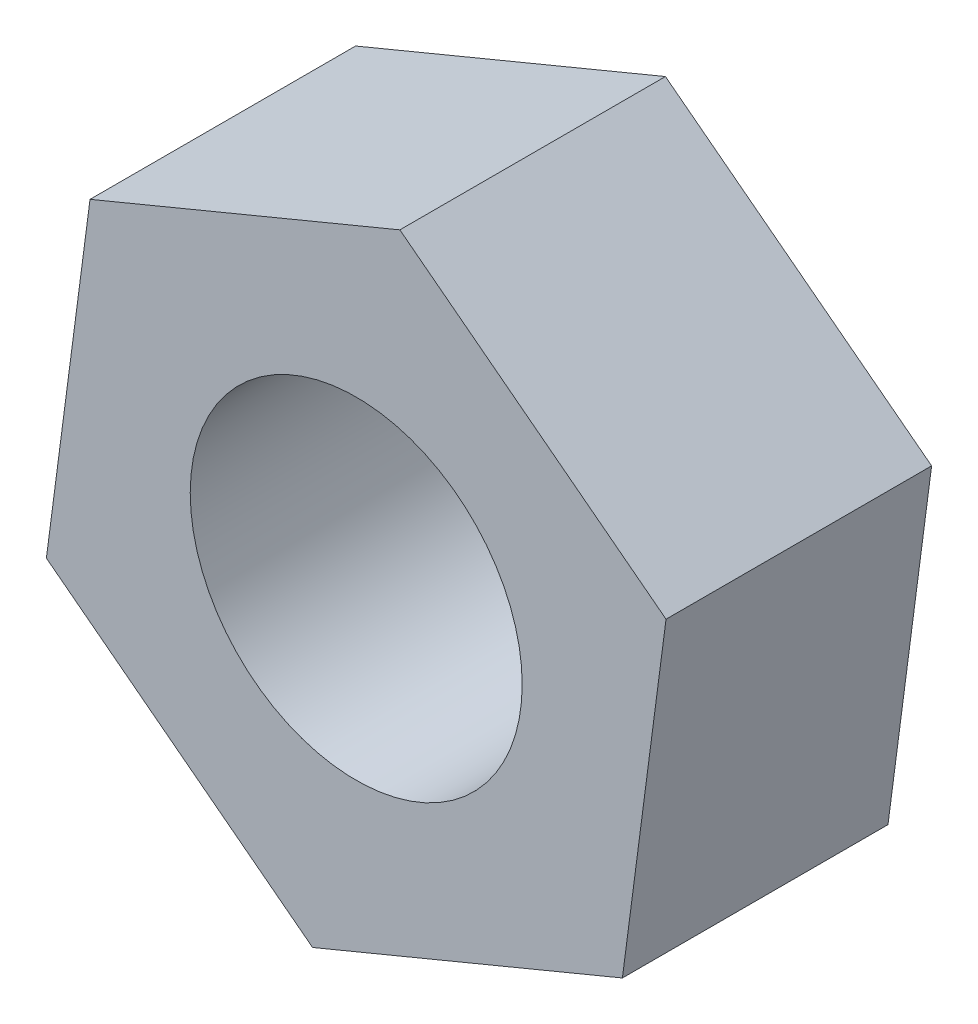
from build123d import *

# Parameters (mm, degrees)
SKETCH_1_R      = 2
EXTRUDE_1_DEPTH = 3.2


with BuildPart() as part:
    # 草图1 → 凸台-拉伸1 (new body)
    with BuildSketch(Plane.XY.offset(-28.5)):
        Polygon((9.525929648, -15.992914858), (5.792727296, -17.540988993), (5.266797648, -21.548074135), (8.474070352, -24.007085142), (12.207272704, -22.459011007), (12.733202352, -18.451925865), align=None)
        with Locations((9, -20)):
            Circle(SKETCH_1_R, mode=Mode.SUBTRACT)
    extrude(amount=-EXTRUDE_1_DEPTH)


solid = part.part
